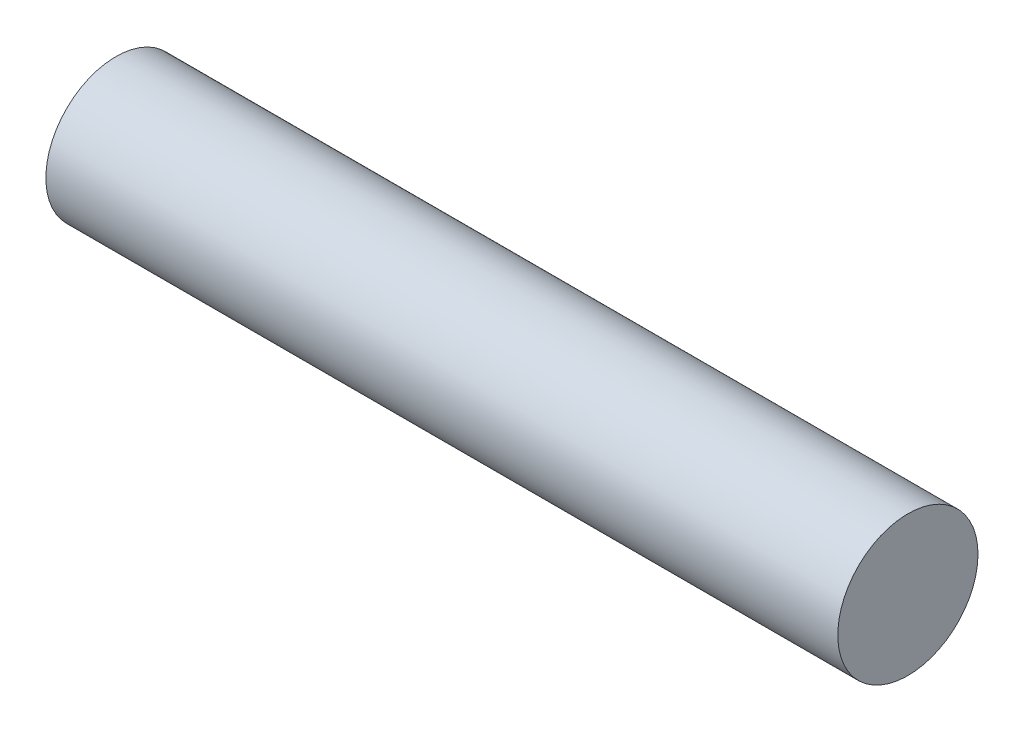
from build123d import *

# Parameters (mm, degrees)
SKETCH1_R           = 12.5
BOSS_EXTRUDE1_DEPTH = 141.2


with BuildPart() as part:
    # Sketch1 → Boss-Extrude1 (new body)
    with BuildSketch(Plane.YZ):
        with Locations(Location((0, 0, 0), (0, 0, 270))):
            Circle(SKETCH1_R)
    extrude(amount=BOSS_EXTRUDE1_DEPTH)


solid = part.part
